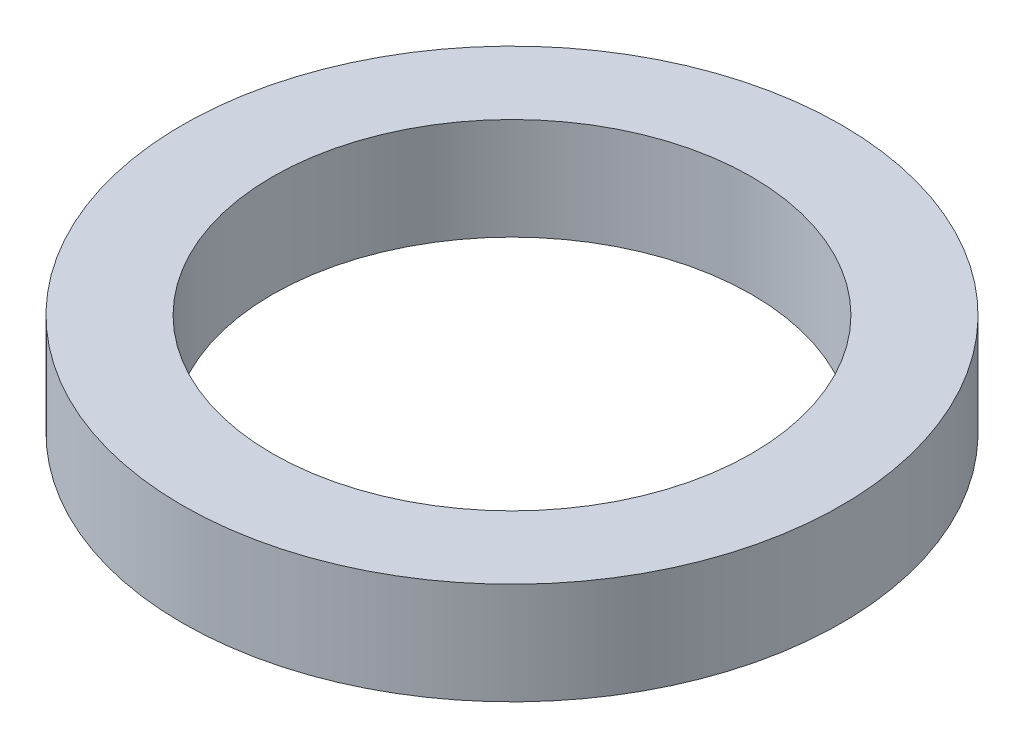
from build123d import *

# Parameters (mm, degrees)
SKETCH_1_R      = 5.5
SKETCH_1_R_2    = 4
EXTRUDE_1_DEPTH = 1.7


with BuildPart() as part:
    # 草图1 → 凸台-拉伸1 (new body)
    with BuildSketch(Plane(origin=(0, 0, 0), x_dir=(1, 0, 0), z_dir=(0, 1, 0))):
        with Locations(Location((0, 0, 0), (0, 0, 270))):
            Circle(SKETCH_1_R)
        with Locations(Location((0, 0, 0), (0, 0, 270))):
            Circle(SKETCH_1_R_2, mode=Mode.SUBTRACT)
    extrude(amount=EXTRUDE_1_DEPTH)


solid = part.part
